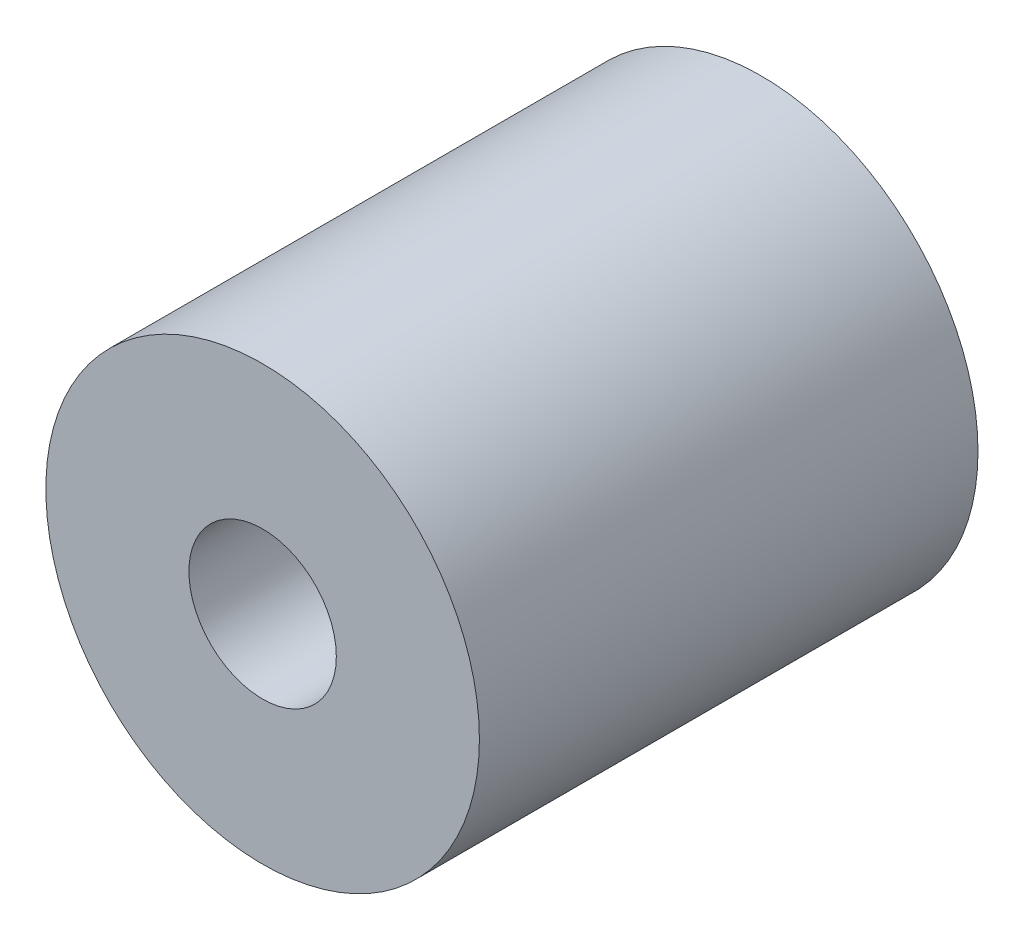
from build123d import *

# Parameters (mm, degrees)
SKETCH1_R           = 5
SKETCH1_R_2         = 1.7
BOSS_EXTRUDE1_DEPTH = 11.5


with BuildPart() as part:
    # Sketch1 → Boss-Extrude1 (new body)
    with BuildSketch(Plane.XY):
        Circle(SKETCH1_R)
        Circle(SKETCH1_R_2, mode=Mode.SUBTRACT)
    extrude(amount=BOSS_EXTRUDE1_DEPTH)


solid = part.part
